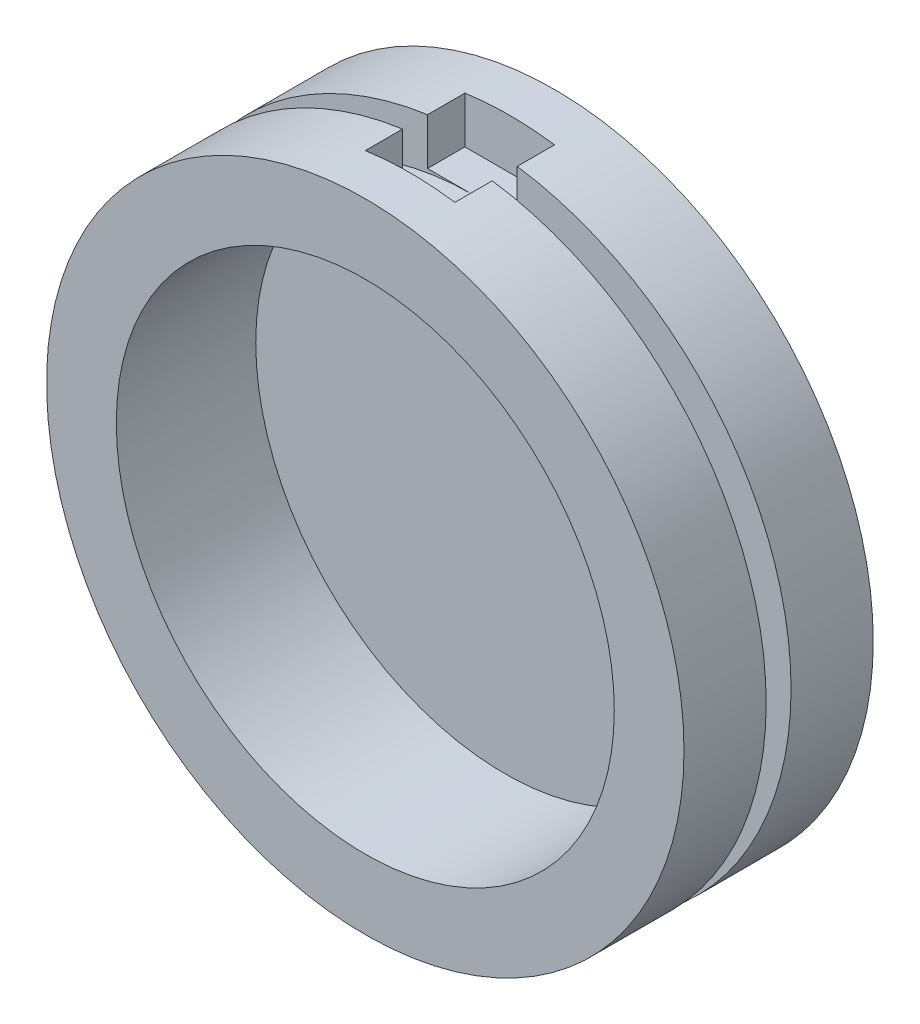
from build123d import *

# Parameters (mm, degrees)
SKETCH7_W          = 9
SKETCH7_H          = 10
CUT_EXTRUDE1_DEPTH = 5


with BuildPart() as part:
    # Sketch2 → Revolve1 (revolve)
    with BuildSketch(Plane(origin=(0, 0, 0), x_dir=(0, 0, -1), z_dir=(1, 0, 0)), mode=Mode.PRIVATE) as revolve1_sk:
        Polygon((0, 0), (0, 32), (-8.25, 32), (-8.25, 27), (-10.75, 27), (-10.75, 32), (-19, 32), (-19, 25), (-5, 25), (-5, 0), align=None)
    revolve(revolve1_sk.sketch.rotate(Axis((0, 0, 5), (0, 0, -1)), 90), axis=Axis((0, 0, 5), (0, 0, -1)))

    # Sketch7 → Cut-Extrude1 (cut)
    with BuildSketch(Plane(origin=(0, 32, 0), x_dir=(1, 0, 0), z_dir=(0, 1, 0))):
        with Locations((0, -9.5)):
            Rectangle(SKETCH7_W, SKETCH7_H)
    cut_extrude1 = extrude(amount=-CUT_EXTRUDE1_DEPTH, mode=Mode.SUBTRACT)

    # Mirror1: Cut-Extrude1 across plane
    add(cut_extrude1.mirror(Plane.ZX), mode=Mode.SUBTRACT)


solid = part.part
